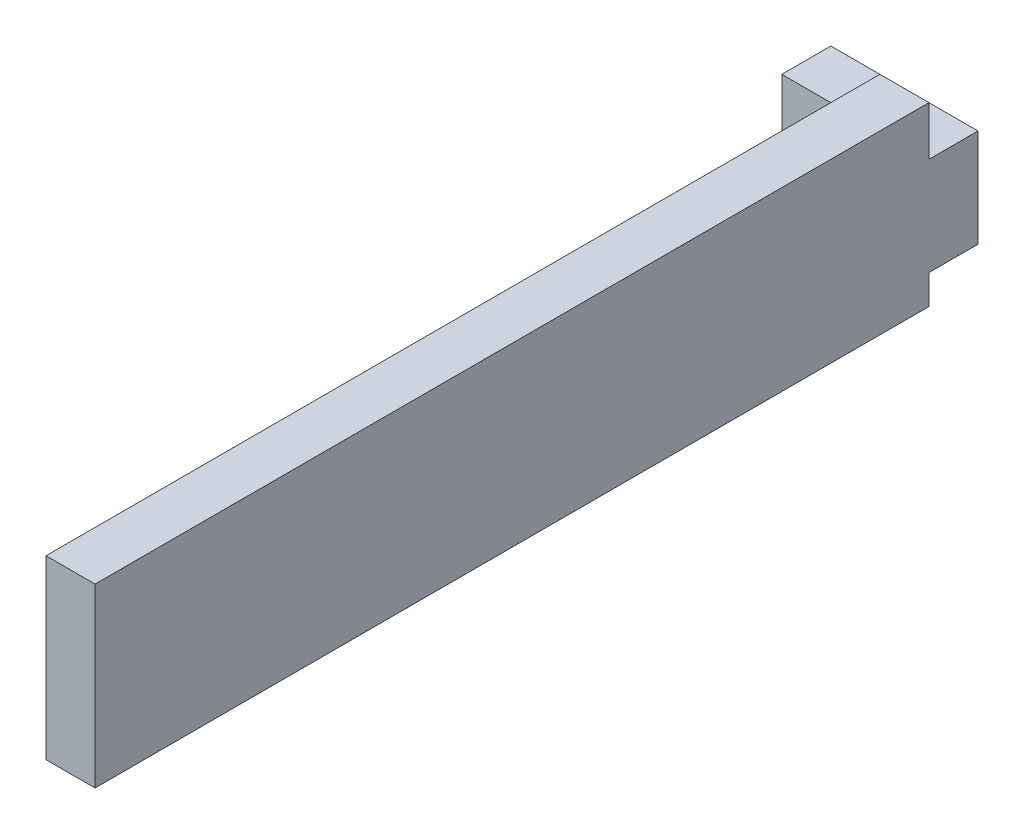
from build123d import *

# Parameters (mm, degrees)
BOSS_EXTRUDE1_DEPTH = 10
SKETCH2_W           = 5
SKETCH2_H           = 85
BOSS_EXTRUDE2_DEPTH = 5
SKETCH4_W           = 5
SKETCH4_H           = 85
BOSS_EXTRUDE4_DEPTH = 3


with BuildPart() as part:
    # Sketch1 → Boss-Extrude1 (new body)
    with BuildSketch(Plane(origin=(0, 0, 0), x_dir=(1, 0, 0), z_dir=(0, 1, 0))):
        Polygon((5, -5), (10, -5), (15, -5), (15, -90), (20, -90), (20, 0), (10, 0), (5, 0), align=None)
    extrude(amount=BOSS_EXTRUDE1_DEPTH)

    # Sketch2 → Boss-Extrude2 (add)
    with BuildSketch(Plane(origin=(0, 10, 0), x_dir=(1, 0, 0), z_dir=(0, 1, 0))):
        with Locations((17.5, -47.5)):
            Rectangle(SKETCH2_W, SKETCH2_H)
    extrude(amount=BOSS_EXTRUDE2_DEPTH)

    # Sketch4 → Boss-Extrude4 (add)
    with BuildSketch(Plane(origin=(0, 0, 0), x_dir=(-1, 0, 0), z_dir=(0, -1, 0))):
        with Locations((-17.5, -47.5)):
            Rectangle(SKETCH4_W, SKETCH4_H)
    extrude(amount=BOSS_EXTRUDE4_DEPTH)


solid = part.part
